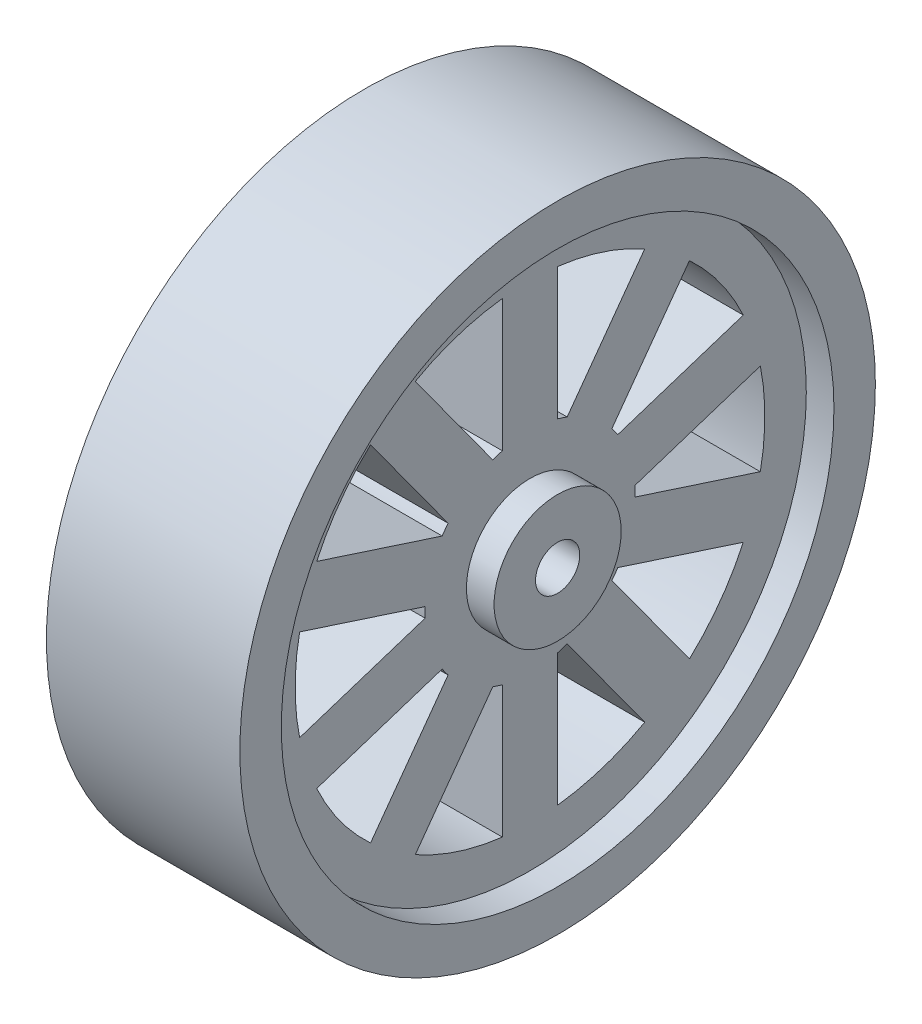
from build123d import *

# Parameters (mm, degrees)
SKETCH1_R               = 29.21
SKETCH1_R_2             = 2.032
BOSS_EXTRUDE1_DEPTH     = 8.89
CUT_EXTRUDE1_DEPTH      = 45.973065272
CUT_EXTRUDE1_DEPTH_BACK = 45.973065272
SKETCH3_R               = 25.4
SKETCH3_R_2             = 5.842
CUT_EXTRUDE2_DEPTH      = 2.54


with BuildPart() as part:
    # Sketch1 → Boss-Extrude1 (new, symmetric)
    with BuildSketch(Plane(origin=(0, 0, 0), x_dir=(0, 0, -1), z_dir=(1, 0, 0))):
        Circle(SKETCH1_R)
        Circle(SKETCH1_R_2, mode=Mode.SUBTRACT)
    extrude(amount=BOSS_EXTRUDE1_DEPTH, both=True)

    # Sketch2 → Cut-Extrude1 (cut, two sides: drawn at the far end of the back side and taken through both)
    with BuildSketch(Plane(origin=(8.89, 0, 0), x_dir=(0, 0, -1), z_dir=(1, 0, 0)).offset(-CUT_EXTRUDE1_DEPTH_BACK)):
        with BuildLine():
            Line((-2.54, 21.44006763), (-2.54, 9.311793812))
            ThreePointArc((-2.54, 9.311793812), (-2.98263203, 9.179597495), (-3.418431909, 9.026373983))
            Line((-3.418431909, 9.026373983), (-10.547252396, 18.838353614))
            ThreePointArc((-10.547252396, 18.838353614), (-6.671676909, 20.533310187), (-2.54, 21.44006763))
        make_face()
        with BuildLine():
            Line((2.54, 21.44006763), (2.54, 9.311793812))
            ThreePointArc((2.54, 9.311793812), (2.98263203, 9.179597495), (3.418431909, 9.026373983))
            Line((3.418431909, 9.026373983), (10.547252396, 18.838353614))
            ThreePointArc((10.547252396, 18.838353614), (6.671676909, 20.533310187), (2.54, 21.44006763))
        make_face()
        with BuildLine():
            Line((14.657058727, 15.852404533), (7.528238241, 6.040424901))
            ThreePointArc((7.528238241, 6.040424901), (7.80863203, 5.673303255), (8.071139018, 5.293186087))
            Line((8.071139018, 5.293186087), (19.605812864, 9.04102881))
            ThreePointArc((19.605812864, 9.04102881), (17.466676909, 12.690283597), (14.657058727, 15.852404533))
        make_face()
        with BuildLine():
            Line((21.175619195, 4.209661707), (9.640945349, 0.461818985))
            ThreePointArc((9.640945349, 0.461818985), (9.652, 0), (9.640945349, -0.461818985))
            Line((9.640945349, -0.461818985), (21.175619195, -4.209661707))
            ThreePointArc((21.175619195, -4.209661707), (21.59, 0), (21.175619195, 4.209661707))
        make_face()
        with BuildLine():
            Line((19.605812864, -9.04102881), (8.071139018, -5.293186087))
            ThreePointArc((8.071139018, -5.293186087), (7.80863203, -5.673303255), (7.528238241, -6.040424901))
            Line((7.528238241, -6.040424901), (14.657058727, -15.852404533))
            ThreePointArc((14.657058727, -15.852404533), (17.466676909, -12.690283597), (19.605812864, -9.04102881))
        make_face()
        with BuildLine():
            Line((10.547252396, -18.838353614), (3.418431909, -9.026373983))
            ThreePointArc((3.418431909, -9.026373983), (2.98263203, -9.179597495), (2.54, -9.311793812))
            Line((2.54, -9.311793812), (2.54, -21.44006763))
            ThreePointArc((2.54, -21.44006763), (6.671676909, -20.533310187), (10.547252396, -18.838353614))
        make_face()
        with BuildLine():
            Line((-2.54, -21.44006763), (-2.54, -9.311793812))
            ThreePointArc((-2.54, -9.311793812), (-2.98263203, -9.179597495), (-3.418431909, -9.026373983))
            Line((-3.418431909, -9.026373983), (-10.547252396, -18.838353614))
            ThreePointArc((-10.547252396, -18.838353614), (-6.671676909, -20.533310187), (-2.54, -21.44006763))
        make_face()
        with BuildLine():
            Line((-14.657058727, -15.852404533), (-7.528238241, -6.040424901))
            ThreePointArc((-7.528238241, -6.040424901), (-7.80863203, -5.673303255), (-8.071139018, -5.293186087))
            Line((-8.071139018, -5.293186087), (-19.605812864, -9.04102881))
            ThreePointArc((-19.605812864, -9.04102881), (-17.466676909, -12.690283597), (-14.657058727, -15.852404533))
        make_face()
        with BuildLine():
            Line((-21.175619195, -4.209661707), (-9.640945349, -0.461818985))
            ThreePointArc((-9.640945349, -0.461818985), (-9.652, 0), (-9.640945349, 0.461818985))
            Line((-9.640945349, 0.461818985), (-21.175619195, 4.209661707))
            ThreePointArc((-21.175619195, 4.209661707), (-21.59, 0), (-21.175619195, -4.209661707))
        make_face()
        with BuildLine():
            Line((-19.605812864, 9.04102881), (-8.071139018, 5.293186087))
            ThreePointArc((-8.071139018, 5.293186087), (-7.80863203, 5.673303255), (-7.528238241, 6.040424901))
            Line((-7.528238241, 6.040424901), (-14.657058727, 15.852404533))
            ThreePointArc((-14.657058727, 15.852404533), (-17.466676909, 12.690283597), (-19.605812864, 9.04102881))
        make_face()
    extrude(amount=CUT_EXTRUDE1_DEPTH + CUT_EXTRUDE1_DEPTH_BACK, mode=Mode.SUBTRACT)

    # Sketch3 → Cut-Extrude2 (cut)
    with BuildSketch(Plane(origin=(8.89, 0, 0), x_dir=(0, 0, -1), z_dir=(1, 0, 0))):
        Circle(SKETCH3_R)
        Circle(SKETCH3_R_2, mode=Mode.SUBTRACT)
    extrude(amount=-CUT_EXTRUDE2_DEPTH, mode=Mode.SUBTRACT)


solid = part.part
